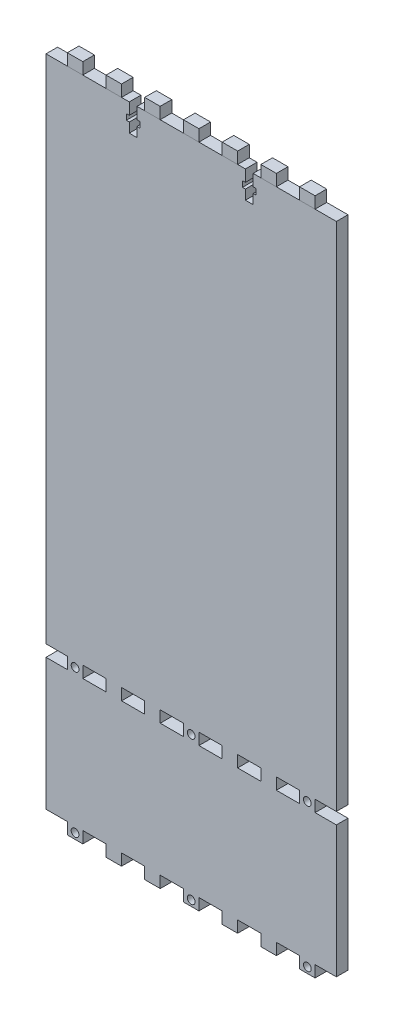
from build123d import *

# Parameters (mm, degrees)
ESQUISSE1_W             = 8
ESQUISSE1_H             = 6
BOSS_EXTRU_1_DEPTH      = 6
ESQUISSE2_W             = 150
ESQUISSE2_H             = 264
BOSS_EXTRU_2_DEPTH      = 6
ESQUISSE3_W             = 8
ESQUISSE3_H             = 6
BOSS_EXTRU_3_DEPTH      = 6
BOSS_EXTRU_3_2_DEPTH    = 6
BOSS_EXTRU_3_3_DEPTH    = 6
BOSS_EXTRU_3_4_DEPTH    = 6
BOSS_EXTRU_3_5_DEPTH    = 6
BOSS_EXTRU_3_6_DEPTH    = 6
BOSS_EXTRU_3_7_DEPTH    = 6
ESQUISSE4_R             = 2
ENL_V_MAT_EXTRU_1_DEPTH = 389.660661272
ESQUISSE5_R             = 2
ENL_V_MAT_EXTRU_2_DEPTH = 389.660661272
ESQUISSE6_W             = 4
ESQUISSE6_H             = 14
ESQUISSE6_W_2           = 7
ESQUISSE6_H_2           = 3
ENL_V_MAT_EXTRU_3_DEPTH = 389.660661272


with BuildPart() as part:
    # Esquisse1 → Boss.-Extru.1 (new body)
    with BuildSketch(Plane.XY):
        with Locations((-151.022684861, 78.365305248)):
            Rectangle(ESQUISSE1_W, ESQUISSE1_H)
        with Locations((-131.022684861, 78.365305248)):
            Rectangle(ESQUISSE1_W, ESQUISSE1_H)
        with Locations((-111.022684861, 78.365305248)):
            Rectangle(ESQUISSE1_W, ESQUISSE1_H)
        with Locations((-91.022684861, 78.365305248)):
            Rectangle(ESQUISSE1_W, ESQUISSE1_H)
        with Locations((-71.022684861, 78.365305248)):
            Rectangle(ESQUISSE1_W, ESQUISSE1_H)
        with Locations((-51.022684861, 78.365305248)):
            Rectangle(ESQUISSE1_W, ESQUISSE1_H)
        with Locations((-31.022684861, 78.365305248)):
            Rectangle(ESQUISSE1_W, ESQUISSE1_H)
        with Locations((-31.022684861, 4.365305248)):
            Rectangle(ESQUISSE1_W, ESQUISSE1_H)
        with Locations((-51.022684861, 4.365305248)):
            Rectangle(ESQUISSE1_W, ESQUISSE1_H)
        with Locations((-71.022684861, 4.365305248)):
            Rectangle(ESQUISSE1_W, ESQUISSE1_H)
        with Locations((-91.022684861, 4.365305248)):
            Rectangle(ESQUISSE1_W, ESQUISSE1_H)
        with Locations((-111.022684861, 4.365305248)):
            Rectangle(ESQUISSE1_W, ESQUISSE1_H)
        with Locations((-131.022684861, 4.365305248)):
            Rectangle(ESQUISSE1_W, ESQUISSE1_H)
        with Locations((-151.022684861, 4.365305248)):
            Rectangle(ESQUISSE1_W, ESQUISSE1_H)
        Polygon((-166.022684861, 41.365305248), (-166.022684861, 7.365305248), (-155.022684861, 7.365305248), (-147.022684861, 7.365305248), (-135.022684861, 7.365305248), (-127.022684861, 7.365305248), (-115.022684861, 7.365305248), (-107.022684861, 7.365305248), (-95.022684861, 7.365305248), (-87.022684861, 7.365305248), (-75.022684861, 7.365305248), (-67.022684861, 7.365305248), (-55.022684861, 7.365305248), (-47.022684861, 7.365305248), (-35.022684861, 7.365305248), (-27.022684861, 7.365305248), (-16.022684861, 7.365305248), (-16.022684861, 41.365305248), align=None)
        Polygon((-166.022684861, 75.365305248), (-166.022684861, 41.365305248), (-16.022684861, 41.365305248), (-16.022684861, 75.365305248), (-27.022684861, 75.365305248), (-35.022684861, 75.365305248), (-47.022684861, 75.365305248), (-55.022684861, 75.365305248), (-67.022684861, 75.365305248), (-75.022684861, 75.365305248), (-87.022684861, 75.365305248), (-95.022684861, 75.365305248), (-107.022684861, 75.365305248), (-115.022684861, 75.365305248), (-127.022684861, 75.365305248), (-135.022684861, 75.365305248), (-147.022684861, 75.365305248), (-155.022684861, 75.365305248), align=None)
    extrude(amount=BOSS_EXTRU_1_DEPTH)

    # Esquisse2 → Boss.-Extru.2 (add)
    with BuildSketch(Plane.XY.offset(6)):
        with Locations((-91.022684861, 213.365305248)):
            Rectangle(ESQUISSE2_W, ESQUISSE2_H)
    extrude(amount=-BOSS_EXTRU_2_DEPTH)

    # Esquisse4 → Enlèv. mat.-Extru.1 (cut, through all)
    with BuildSketch(Plane.XY.offset(6)):
        with Locations((-31.022684861, 78.365305248)):
            Circle(ESQUISSE4_R)
        with Locations((-151.022684861, 78.365305248)):
            Circle(ESQUISSE4_R)
        with Locations((-91.022684861, 78.365305248)):
            Circle(ESQUISSE4_R)
    extrude(amount=-ENL_V_MAT_EXTRU_1_DEPTH, mode=Mode.SUBTRACT)

    # Esquisse5 → Enlèv. mat.-Extru.2 (cut, through all)
    with BuildSketch(Plane.XY.offset(6)):
        with Locations((-151.022684861, 4.365305248)):
            Circle(ESQUISSE5_R)
        with Locations((-91.022684861, 4.365305248)):
            Circle(ESQUISSE5_R)
        with Locations((-31.022684861, 4.365305248)):
            Circle(ESQUISSE5_R)
    extrude(amount=-ENL_V_MAT_EXTRU_2_DEPTH, mode=Mode.SUBTRACT)

    # Esquisse6 → Enlèv. mat.-Extru.3 (cut, through all)
    with BuildSketch(Plane.XY.offset(6)):
        with Locations((-121.022684861, 338.365305248)):
            Rectangle(ESQUISSE6_W, ESQUISSE6_H)
        with Locations((-121.022684861, 337.865305248)):
            Rectangle(ESQUISSE6_W_2, ESQUISSE6_H_2)
        with Locations((-61.022684861, 338.365305248)):
            Rectangle(ESQUISSE6_W, ESQUISSE6_H)
        with Locations((-61.022684861, 337.865305248)):
            Rectangle(ESQUISSE6_W_2, ESQUISSE6_H_2)
    extrude(amount=-ENL_V_MAT_EXTRU_3_DEPTH, mode=Mode.SUBTRACT)


with BuildPart() as body_2:
    # Esquisse3 → Boss.-Extru.3 (new body)
    with BuildSketch(Plane.XY.offset(6)):
        with Locations((-151.022684861, 348.365305248)):
            Rectangle(ESQUISSE3_W, ESQUISSE3_H)
    extrude(amount=-BOSS_EXTRU_3_DEPTH)


with BuildPart() as body_3:
    # Esquisse3 → Boss.-Extru.3 2 (new body)
    with BuildSketch(Plane.XY.offset(6)):
        with Locations((-131.022684861, 348.365305248)):
            Rectangle(ESQUISSE3_W, ESQUISSE3_H)
    extrude(amount=-BOSS_EXTRU_3_2_DEPTH)


with BuildPart() as body_4:
    # Esquisse3 → Boss.-Extru.3 3 (new body)
    with BuildSketch(Plane.XY.offset(6)):
        with Locations((-111.059834835, 348.365305248)):
            Rectangle(ESQUISSE3_W, ESQUISSE3_H)
    extrude(amount=-BOSS_EXTRU_3_3_DEPTH)


with BuildPart() as body_5:
    # Esquisse3 → Boss.-Extru.3 4 (new body)
    with BuildSketch(Plane.XY.offset(6)):
        with Locations((-91.022684861, 348.365305248)):
            Rectangle(ESQUISSE3_W, ESQUISSE3_H)
    extrude(amount=-BOSS_EXTRU_3_4_DEPTH)


with BuildPart() as body_6:
    # Esquisse3 → Boss.-Extru.3 5 (new body)
    with BuildSketch(Plane.XY.offset(6)):
        with Locations((-71.022684861, 348.365305248)):
            Rectangle(ESQUISSE3_W, ESQUISSE3_H)
    extrude(amount=-BOSS_EXTRU_3_5_DEPTH)


with BuildPart() as body_7:
    # Esquisse3 → Boss.-Extru.3 6 (new body)
    with BuildSketch(Plane.XY.offset(6)):
        with Locations((-51.022684861, 348.365305248)):
            Rectangle(ESQUISSE3_W, ESQUISSE3_H)
    extrude(amount=-BOSS_EXTRU_3_6_DEPTH)


with BuildPart() as body_8:
    # Esquisse3 → Boss.-Extru.3 7 (new body)
    with BuildSketch(Plane.XY.offset(6)):
        with Locations((-31.022684861, 348.365305248)):
            Rectangle(ESQUISSE3_W, ESQUISSE3_H)
    extrude(amount=-BOSS_EXTRU_3_7_DEPTH)


solid = Compound([part.part, body_2.part, body_3.part, body_4.part, body_5.part, body_6.part, body_7.part, body_8.part])
